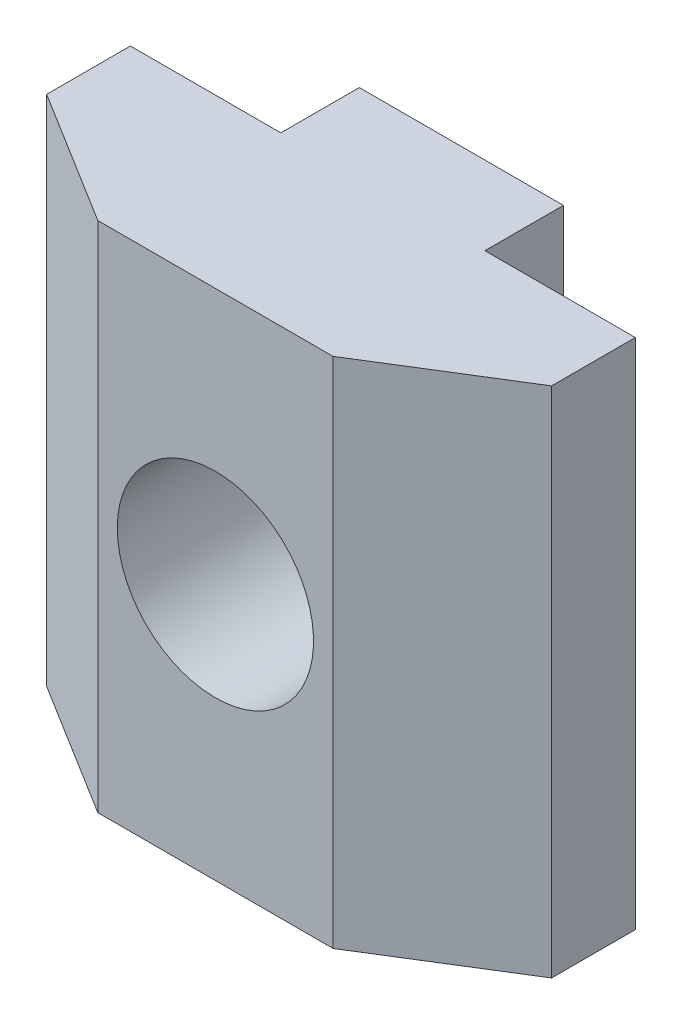
from build123d import *

# Parameters (mm, degrees)
EXTRUDE_1_DEPTH     = 19.6
SKETCH_2_R          = 3.75
CUT_EXTRUDE_1_DEPTH = 24.783239897


with BuildPart() as part:
    # 草图1 → 凸台-拉伸1 (new body)
    with BuildSketch(Plane(origin=(0, 0, 0), x_dir=(1, 0, 0), z_dir=(0, 1, 0))):
        Polygon((-4.495, 0), (4.495, 0), (9.65, 3.2), (9.65, 6.4), (3.9, 6.4), (3.9, 9.4), (-3.9, 9.4), (-3.9, 6.4), (-9.65, 6.4), (-9.65, 3.2), align=None)
    extrude(amount=EXTRUDE_1_DEPTH)

    # 草图2 → 切除-拉伸1 (cut, through all)
    with BuildSketch(Plane(origin=(0, 0, -9.4), x_dir=(-1, 0, 0), z_dir=(0, 0, -1))):
        with Locations((0, 9.8)):
            Circle(SKETCH_2_R)
    extrude(amount=-CUT_EXTRUDE_1_DEPTH, mode=Mode.SUBTRACT)


solid = part.part
